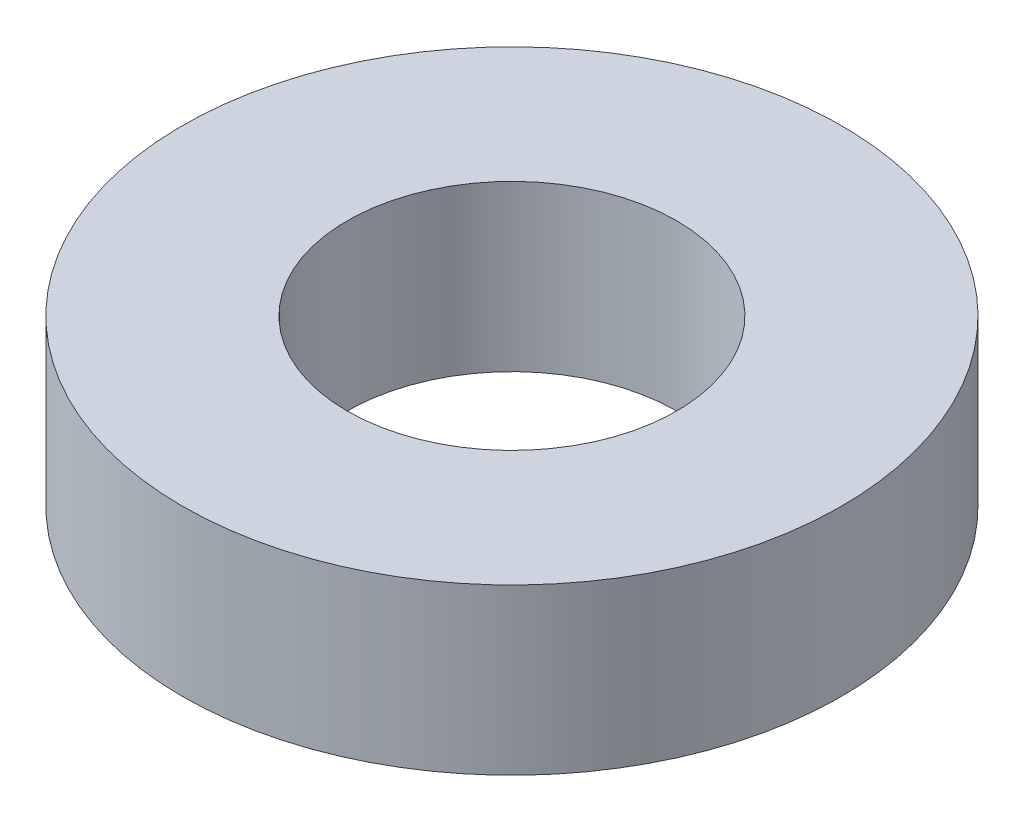
from build123d import *

# Parameters (mm, degrees)
SKETCH_1_R      = 8
SKETCH_1_R_2    = 4
EXTRUDE_1_DEPTH = 4


with BuildPart() as part:
    # 草图1 → 凸台-拉伸1 (new body)
    with BuildSketch(Plane(origin=(0, 0, 0), x_dir=(1, 0, 0), z_dir=(0, 1, 0))):
        with Locations(Location((0, 0, 0), (0, 0, 270))):
            Circle(SKETCH_1_R)
        with Locations(Location((0, 0, 0), (0, 0, 270))):
            Circle(SKETCH_1_R_2, mode=Mode.SUBTRACT)
    extrude(amount=EXTRUDE_1_DEPTH)


solid = part.part
